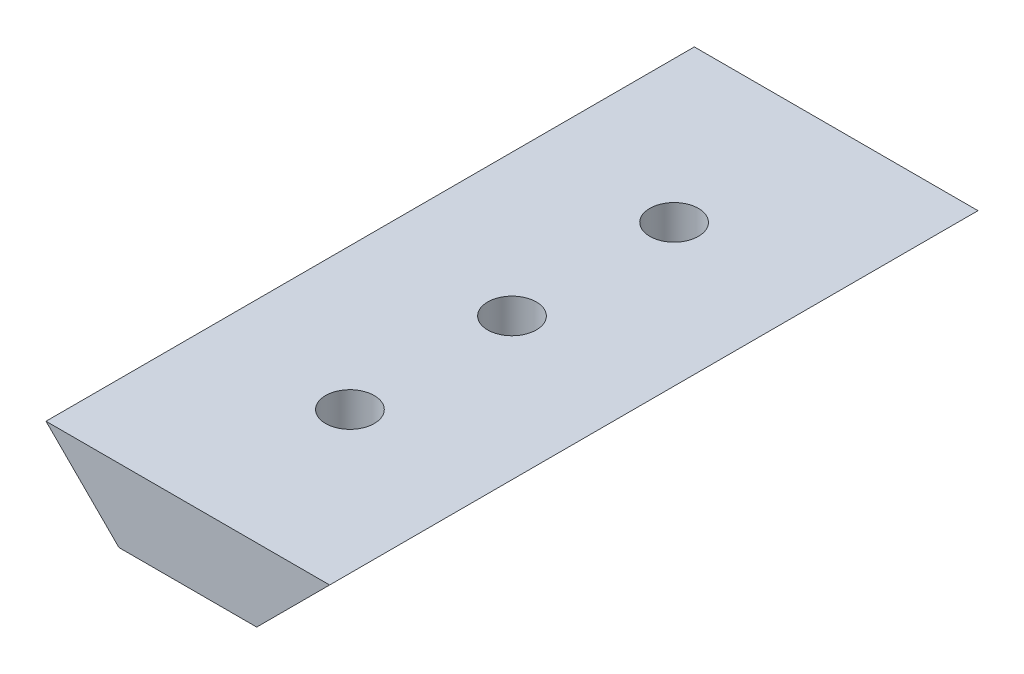
from build123d import *

# Parameters (mm, degrees)
RESSALTO_EXTRUS_O1_DEPTH = 40
CORTE_EXTRUS_O1_REACH    = 43.192
ESBO_O2_R                = 1.5


with BuildPart() as part:
    # Esboço1 → Ressalto-extrusão1 (new body)
    with BuildSketch(Plane.XY):
        Polygon((-8.75, 2.25), (8.75, 2.25), (4.25, -2.25), (-4.25, -2.25), align=None)
    extrude(amount=RESSALTO_EXTRUS_O1_DEPTH)

    # Esboço2 → Corte-extrusão1 (cut, up to next)
    with BuildSketch(Plane(origin=(0, 2.25, 0), x_dir=(1, 0, 0), z_dir=(0, 1, 0)), mode=Mode.PRIVATE) as corte_extrus_o1_sk1:
        with Locations(Location((0, -20, 0), (0, 0, 180))):
            Circle(ESBO_O2_R)
    corte_extrus_o1_tool1 = extrude(corte_extrus_o1_sk1.sketch, amount=-CORTE_EXTRUS_O1_REACH, mode=Mode.PRIVATE) & part.part
    # Esboço2 → Corte-extrusão1 (cut, up to next)
    with BuildSketch(Plane(origin=(0, 2.25, 0), x_dir=(1, 0, 0), z_dir=(0, 1, 0)), mode=Mode.PRIVATE) as corte_extrus_o1_sk2:
        with Locations(Location((0, -10, 0), (0, 0, 180))):
            Circle(ESBO_O2_R)
    corte_extrus_o1_tool2 = extrude(corte_extrus_o1_sk2.sketch, amount=-CORTE_EXTRUS_O1_REACH, mode=Mode.PRIVATE) & part.part
    # Esboço2 → Corte-extrusão1 (cut, up to next)
    with BuildSketch(Plane(origin=(0, 2.25, 0), x_dir=(1, 0, 0), z_dir=(0, 1, 0)), mode=Mode.PRIVATE) as corte_extrus_o1_sk3:
        with Locations(Location((0, -30, 0), (0, 0, 180))):
            Circle(ESBO_O2_R)
    corte_extrus_o1_tool3 = extrude(corte_extrus_o1_sk3.sketch, amount=-CORTE_EXTRUS_O1_REACH, mode=Mode.PRIVATE) & part.part
    add(corte_extrus_o1_tool1.solids().sort_by_distance((0, 2.25, 20))[0], mode=Mode.SUBTRACT)
    add(corte_extrus_o1_tool2.solids().sort_by_distance((0, 2.25, 10))[0], mode=Mode.SUBTRACT)
    add(corte_extrus_o1_tool3.solids().sort_by_distance((0, 2.25, 30))[0], mode=Mode.SUBTRACT)


solid = part.part
